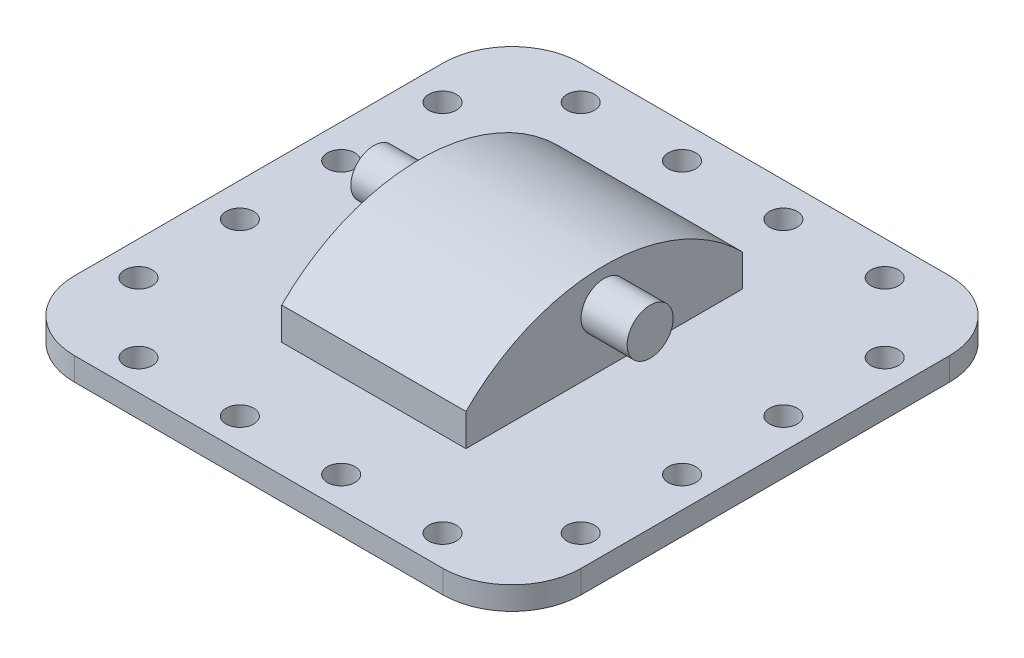
from build123d import *

# Parameters (mm, degrees)
SKETCH1_W                = 110
SKETCH1_H                = 110
BOSS_EXTRUDE1_DEPTH      = 5
FILLET2_R                = 15
FILLET3_R                = 15
FILLET4_R                = 15
FILLET5_R                = 15
SKETCH2_W                = 40
SKETCH2_H                = 60
BOSS_EXTRUDE2_DEPTH      = 24
BOSS_EXTRUDE3_DEPTH      = 10
BOSS_EXTRUDE3_DEPTH_BACK = 50
SKETCH4_R                = 5
FILLET6_R                = 10
FILLET7_R                = 10
SKETCH5_R                = 3
CUT_EXTRUDE1_DEPTH       = 10
CUT_EXTRUDE2_DEPTH       = 60


with BuildPart() as part:
    # Sketch1 → Boss-Extrude1 (new body)
    with BuildSketch(Plane(origin=(0, 0, 0), x_dir=(1, 0, 0), z_dir=(0, 1, 0))):
        Rectangle(SKETCH1_W, SKETCH1_H)
    extrude(amount=BOSS_EXTRUDE1_DEPTH)

    # Fillet2
    fillet2_edges = [part.edges().sort_by_distance(p)[0] for p in [
        (55, 2.5, -55),
    ]]
    fillet(fillet2_edges, radius=FILLET2_R)

    # Fillet3
    fillet3_edges = [part.edges().sort_by_distance(p)[0] for p in [
        (-55, 2.5, -55),
    ]]
    fillet(fillet3_edges, radius=FILLET3_R)

    # Fillet4
    fillet4_edges = [part.edges().sort_by_distance(p)[0] for p in [
        (-55, 2.5, 55),
    ]]
    fillet(fillet4_edges, radius=FILLET4_R)

    # Fillet5
    fillet5_edges = [part.edges().sort_by_distance(p)[0] for p in [
        (55, 2.5, 55),
    ]]
    fillet(fillet5_edges, radius=FILLET5_R)

    # Sketch2 → Boss-Extrude2 (add)
    with BuildSketch(Plane(origin=(0, 5, 0), x_dir=(1, 0, 0), z_dir=(0, 1, 0))):
        Rectangle(SKETCH2_W, SKETCH2_H)
    extrude(amount=BOSS_EXTRUDE2_DEPTH)

    # Sketch4 → Boss-Extrude3 (add, two sides: drawn at the far end of the back side and taken through both)
    with BuildSketch(Plane(origin=(20, 0, 0), x_dir=(0, 0, -1), z_dir=(1, 0, 0)).offset(-BOSS_EXTRUDE3_DEPTH_BACK)):
        with Locations((0, 17)):
            Circle(SKETCH4_R)
    extrude(amount=BOSS_EXTRUDE3_DEPTH + BOSS_EXTRUDE3_DEPTH_BACK)

    # Fillet6
    fillet6_edges = [part.edges().sort_by_distance(p)[0] for p in [
        (0, 29, 30),
    ]]
    fillet(fillet6_edges, radius=FILLET6_R)

    # Fillet7
    fillet7_edges = [part.edges().sort_by_distance(p)[0] for p in [
        (0, 29, -30),
    ]]
    fillet(fillet7_edges, radius=FILLET7_R)

    # Sketch5 → Cut-Extrude1 (cut)
    with BuildSketch(Plane.XZ):
        with Locations(Location((48.334696306, -10.581629618, 0), (0, 0, 270))):
            Circle(SKETCH5_R)
        with Locations(Location((48.334696306, 33.418370382, 0), (0, 0, 270))):
            Circle(SKETCH5_R)
        with Locations(Location((-47.665303694, 11.418370382, 0), (0, 0, 270))):
            Circle(SKETCH5_R)
        with Locations(Location((-47.665303694, -10.581629618, 0), (0, 0, 270))):
            Circle(SKETCH5_R)
        with Locations(Location((-47.665303694, -32.581629618, 0), (0, 0, 270))):
            Circle(SKETCH5_R)
        with Locations(Location((-32.665303694, -47.581629618, 0), (0, 0, 270))):
            Circle(SKETCH5_R)
        with Locations(Location((-10.665303694, -47.581629618, 0), (0, 0, 270))):
            Circle(SKETCH5_R)
        with Locations(Location((11.334696306, -47.581629618, 0), (0, 0, 270))):
            Circle(SKETCH5_R)
        with Locations(Location((33.334696306, -47.581629618, 0), (0, 0, 270))):
            Circle(SKETCH5_R)
        with Locations(Location((48.334696306, -32.581629618, 0), (0, 0, 270))):
            Circle(SKETCH5_R)
        with Locations(Location((48.334696306, 11.418370382, 0), (0, 0, 270))):
            Circle(SKETCH5_R)
        with Locations(Location((33.334696306, 48.418370382, 0), (0, 0, 270))):
            Circle(SKETCH5_R)
        with Locations(Location((11.334696306, 48.418370382, 0), (0, 0, 270))):
            Circle(SKETCH5_R)
        with Locations(Location((-10.665303694, 48.418370382, 0), (0, 0, 270))):
            Circle(SKETCH5_R)
        with Locations(Location((-32.665303694, 48.418370382, 0), (0, 0, 270))):
            Circle(SKETCH5_R)
        with Locations(Location((-47.665303694, 33.418370382, 0), (0, 0, 270))):
            Circle(SKETCH5_R)
    extrude(amount=-CUT_EXTRUDE1_DEPTH, mode=Mode.SUBTRACT)

    # Sketch6 → Cut-Extrude2 (cut)
    with BuildSketch(Plane(origin=(20, 0, 0), x_dir=(0, 0, -1), z_dir=(1, 0, 0))):
        with BuildLine():
            Line((30, 19), (30, 12))
            ThreePointArc((30, 12), (0, 24.426406871), (-30, 12))
            Line((-30, 12), (-30, 19))
            ThreePointArc((-30, 19), (-27.071067812, 26.071067812), (-20, 29))
            Line((-20, 29), (20, 29))
            ThreePointArc((20, 29), (27.071067812, 26.071067812), (30, 19))
        make_face()
    extrude(amount=-CUT_EXTRUDE2_DEPTH, mode=Mode.SUBTRACT)


solid = part.part
